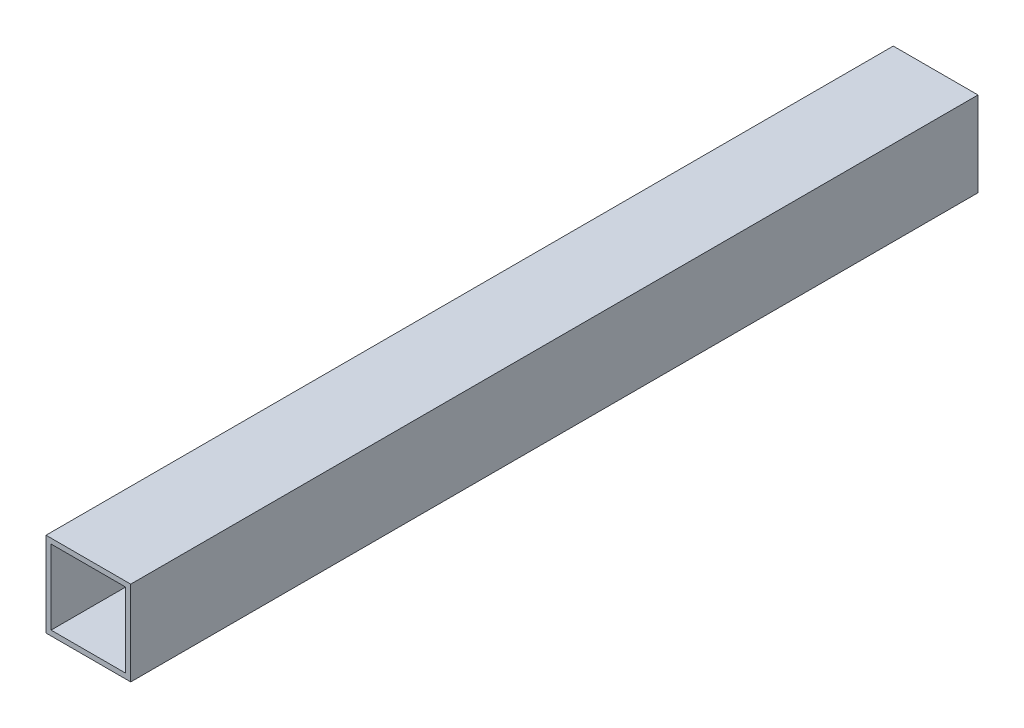
from build123d import *

# Parameters (mm, degrees)
SKETCH_1_W      = 50
SKETCH_1_H      = 50
SKETCH_1_W_2    = 44
SKETCH_1_H_2    = 44
EXTRUDE_1_DEPTH = 250


with BuildPart() as part:
    # 草图1 → 凸台-拉伸1 (new, symmetric)
    with BuildSketch(Plane.XY):
        Rectangle(SKETCH_1_W, SKETCH_1_H)
        Rectangle(SKETCH_1_W_2, SKETCH_1_H_2, mode=Mode.SUBTRACT)
    extrude(amount=EXTRUDE_1_DEPTH, both=True)


solid = part.part
